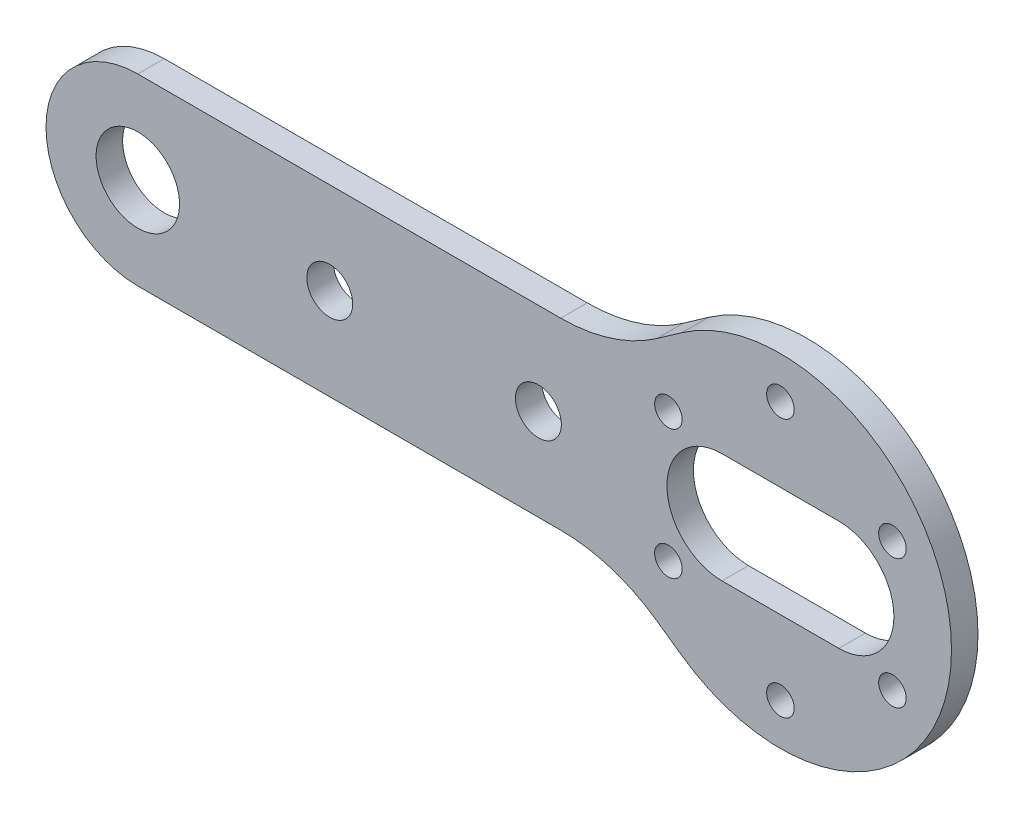
from build123d import *

# Parameters (mm, degrees)
CROQUIS2_R                       = 1.65
CROQUIS2_R_2                     = 5
SALIENTE_EXTRUIR1_DEPTH          = 3.175
TALADRO_DE_MARGEN_PARA_M51_D     = 5.5
TALADRO_DE_MARGEN_PARA_M51_DEPTH = 6
TALADRO_DE_MARGEN_PARA_M51_TIP   = 1.652366702
REDONDEO1_R                      = 20


with BuildPart() as part:
    # Croquis2 → Saliente-Extruir1 (new body)
    with BuildSketch(Plane.XY.offset(64.203907482)):
        with BuildLine():
            Line((82.563009481, 31.349424269), (74.351031643, 25.577646382))
            Line((74.351031643, 25.577646382), (17.351031643, 25.577646382))
            ThreePointArc((17.351031643, 25.577646382), (6.351031643, 14.577646382), (17.351031643, 3.577646382))
            Line((17.351031643, 3.577646382), (74.351031643, 3.577646382))
            Line((74.351031643, 3.577646382), (82.563009481, -2.194131506))
            ThreePointArc((82.563009481, -2.194131506), (114.851031643, 14.577646382), (82.563009481, 31.349424269))
        make_face()
        with Locations((94.351031643, -0.922353618)):
            Circle(CROQUIS2_R, mode=Mode.SUBTRACT)
        with Locations((80.927637885, 6.827646382)):
            Circle(CROQUIS2_R, mode=Mode.SUBTRACT)
        with Locations((80.927637885, 22.327646382)):
            Circle(CROQUIS2_R, mode=Mode.SUBTRACT)
        with Locations((94.351031643, 30.077646382)):
            Circle(CROQUIS2_R, mode=Mode.SUBTRACT)
        with Locations((107.774425402, 22.327646382)):
            Circle(CROQUIS2_R, mode=Mode.SUBTRACT)
        with Locations((107.774425402, 6.827646382)):
            Circle(CROQUIS2_R, mode=Mode.SUBTRACT)
        with Locations(Location((17.351031643, 14.577646382, 0), (0, 0, 180))):
            Circle(CROQUIS2_R_2, mode=Mode.SUBTRACT)
        with BuildLine():
            Line((87.351031643, 21.177646382), (101.351031643, 21.177646382))
            ThreePointArc((101.351031643, 21.177646382), (107.951031643, 14.577646382), (101.351031643, 7.977646382))
            Line((101.351031643, 7.977646382), (87.351031643, 7.977646382))
            ThreePointArc((87.351031643, 7.977646382), (80.751031643, 14.577646382), (87.351031643, 21.177646382))
        make_face(mode=Mode.SUBTRACT)
    extrude(amount=SALIENTE_EXTRUIR1_DEPTH)

    # Taladro de margen para M51
    with Locations(Plane(origin=(0, 0, 64.203907482), x_dir=(-1, 0, 0), z_dir=(0, 0, -1))):
        with Locations((-65.351031643, 14.577646382), (-40.351031643, 14.577646382)):
            Hole(TALADRO_DE_MARGEN_PARA_M51_D / 2, depth=TALADRO_DE_MARGEN_PARA_M51_DEPTH)
            with Locations((0, 0, -(TALADRO_DE_MARGEN_PARA_M51_DEPTH + TALADRO_DE_MARGEN_PARA_M51_TIP / 2))):  # 118° drill point
                Cone(0, TALADRO_DE_MARGEN_PARA_M51_D / 2, TALADRO_DE_MARGEN_PARA_M51_TIP, mode=Mode.SUBTRACT)

    # Redondeo1
    redondeo1_edges = [part.edges().sort_by_distance(p)[0] for p in [
        (74.351031643, 3.577646382, 65.791407482),
        (74.351031643, 25.577646382, 65.791407482),
    ]]
    fillet(redondeo1_edges, radius=REDONDEO1_R)


solid = part.part
